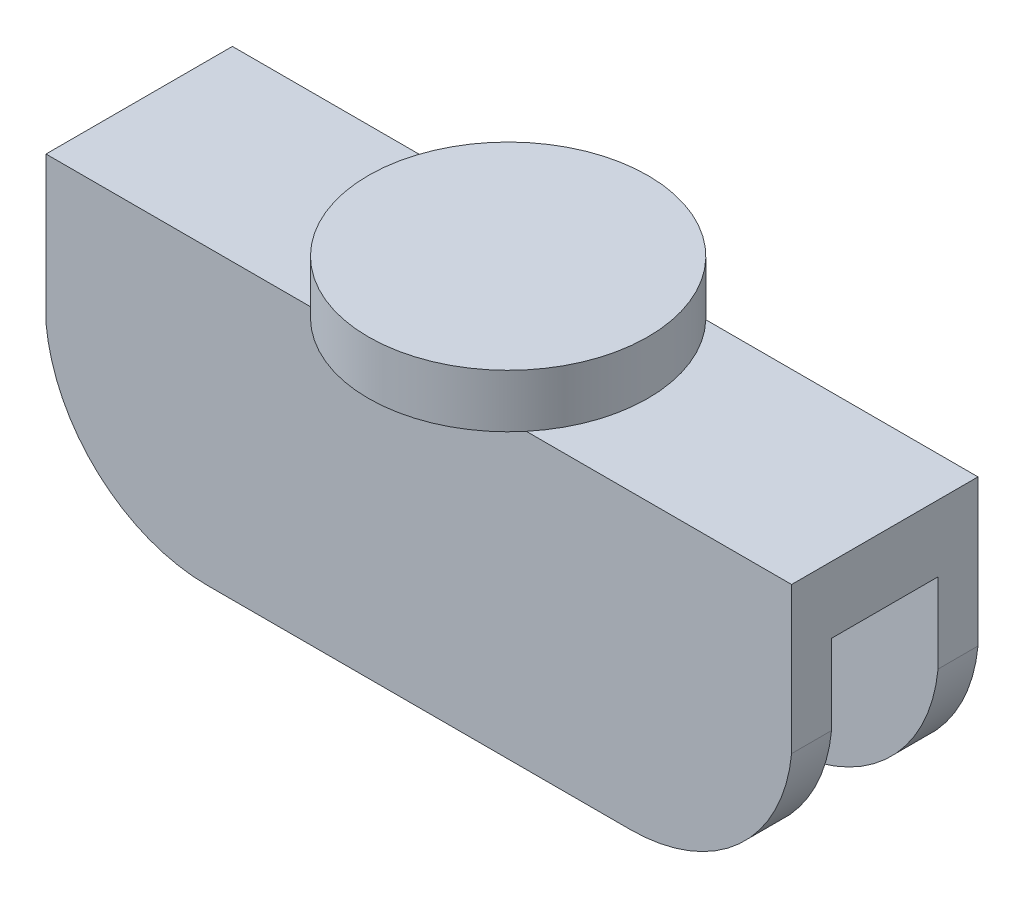
from build123d import *

# Parameters (mm, degrees)
SKETCH1_W           = 140
SKETCH1_H           = 55
BOSS_EXTRUDE1_DEPTH = 35
CUT_EXTRUDE1_DEPTH  = 120
SKETCH4_R           = 26.25
BOSS_EXTRUDE2_DEPTH = 10
SKETCH5_W           = 140
SKETCH5_H           = 20
CUT_EXTRUDE2_DEPTH  = 94.189460294


with BuildPart() as part:
    # Sketch1 → Boss-Extrude1 (new body)
    with BuildSketch(Plane.XY):
        Rectangle(SKETCH1_W, SKETCH1_H)
    extrude(amount=BOSS_EXTRUDE1_DEPTH)

    # Sketch2 → Cut-Extrude1 (cut)
    with BuildSketch(Plane.XY.offset(35)):
        with BuildLine():
            ThreePointArc((70, 0), (60.149153929, -19.600749097), (39.683808374, -27.5))
            Line((39.683808374, -27.5), (70, -27.5))
            Line((70, -27.5), (70, 0))
        make_face()
        with BuildLine():
            Line((-70, -27.5), (-39.683808374, -27.5))
            ThreePointArc((-39.683808374, -27.5), (-60.149153929, -19.600749097), (-70, 0))
            Line((-70, 0), (-70, -27.5))
        make_face()
    extrude(amount=-CUT_EXTRUDE1_DEPTH, mode=Mode.SUBTRACT)

    # Sketch4 → Boss-Extrude2 (add)
    with BuildSketch(Plane(origin=(0, 27.5, 0), x_dir=(1, 0, 0), z_dir=(0, 1, 0))):
        with Locations(Location((0, -18.224998705, 0), (0, 0, 43.97032124))):
            Circle(SKETCH4_R)
    extrude(amount=BOSS_EXTRUDE2_DEPTH)

    # Sketch5 → Cut-Extrude2 (cut, through all)
    with BuildSketch(Plane(origin=(0, 15, 0), x_dir=(1, 0, 0), z_dir=(0, 1, 0))):
        with Locations((0, -17.5)):
            Rectangle(SKETCH5_W, SKETCH5_H)
    extrude(amount=-CUT_EXTRUDE2_DEPTH, mode=Mode.SUBTRACT)


solid = part.part
